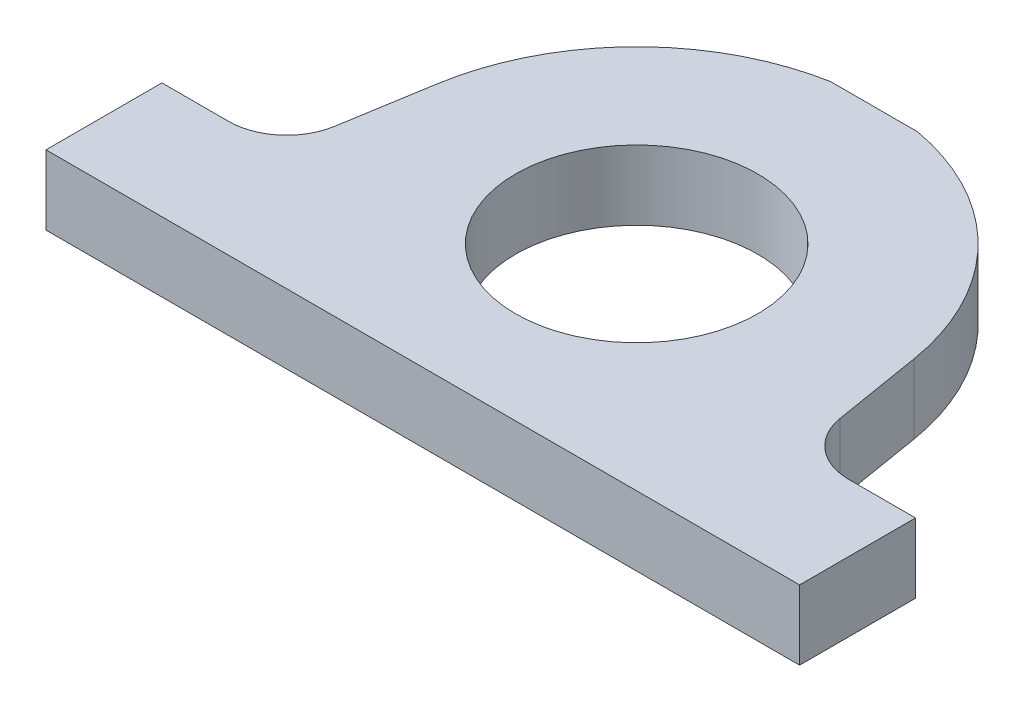
from build123d import *

# Parameters (mm, degrees)
SKETCH1_R           = 20.9
BOSS_EXTRUDE1_DEPTH = 12
SKETCH2_R           = 1
CUT_EXTRUDE1_DEPTH  = 3
SKETCH3_R           = 1
CUT_EXTRUDE2_DEPTH  = 3
FILLET1_R           = 10
SKETCH4_W           = 15
SKETCH4_H           = 3.988700157
CUT_EXTRUDE3_DEPTH  = 79.126323989
SKETCH8_R           = 1
CUT_EXTRUDE4_DEPTH  = 2


with BuildPart() as part:
    # Sketch1 → Boss-Extrude1 (new body)
    with BuildSketch(Plane(origin=(0, 0, 0), x_dir=(1, 0, 0), z_dir=(0, 1, 0))):
        with BuildLine():
            Line((-41.094820281, 6.777775896), (-45, -16.9))
            Line((-45, -16.9), (-65, -16.9))
            Line((-65, -16.9), (-65, -36.9))
            Line((-65, -36.9), (65, -36.9))
            Line((65, -36.9), (65, -16.9))
            Line((65, -16.9), (45, -16.9))
            Line((45, -16.9), (41.094820281, 6.777775896))
            ThreePointArc((41.094820281, 6.777775896), (0, 41.65), (-41.094820281, 6.777775896))
        make_face()
        with Locations(Location((0, 0, 0), (0, 0, 270))):
            Circle(SKETCH1_R, mode=Mode.SUBTRACT)
    extrude(amount=BOSS_EXTRUDE1_DEPTH)

    # Sketch2 → Cut-Extrude1 (cut)
    with BuildSketch(Plane(origin=(0, 0, 16.9), x_dir=(-1, 0, 0), z_dir=(0, 0, -1))):
        with Locations((-55, 6)):
            Circle(SKETCH2_R)
    extrude(amount=-CUT_EXTRUDE1_DEPTH, mode=Mode.SUBTRACT)

    # Sketch3 → Cut-Extrude2 (cut)
    with BuildSketch(Plane(origin=(0, 0, 16.9), x_dir=(-1, 0, 0), z_dir=(0, 0, -1))):
        with Locations((55, 6)):
            Circle(SKETCH3_R)
    extrude(amount=-CUT_EXTRUDE2_DEPTH, mode=Mode.SUBTRACT)

    # Fillet1
    fillet1_edges = [part.edges().sort_by_distance(p)[0] for p in [
        (-45, 6, 16.9),
        (45, 6, 16.9),
    ]]
    fillet(fillet1_edges, radius=FILLET1_R)

    # Sketch4 → Cut-Extrude3 (cut, through all)
    with BuildSketch(Plane.XZ):
        with Locations((0, -42.963515313)):
            Rectangle(SKETCH4_W, SKETCH4_H)
    extrude(amount=-CUT_EXTRUDE3_DEPTH, mode=Mode.SUBTRACT)

    # Sketch8 → Cut-Extrude4 (cut)
    with BuildSketch(Plane(origin=(0, 0, -40.969165234), x_dir=(-1, 0, 0), z_dir=(0, 0, -1))):
        with Locations((0, 4)):
            Circle(SKETCH8_R)
    extrude(amount=-CUT_EXTRUDE4_DEPTH, mode=Mode.SUBTRACT)


solid = part.part
